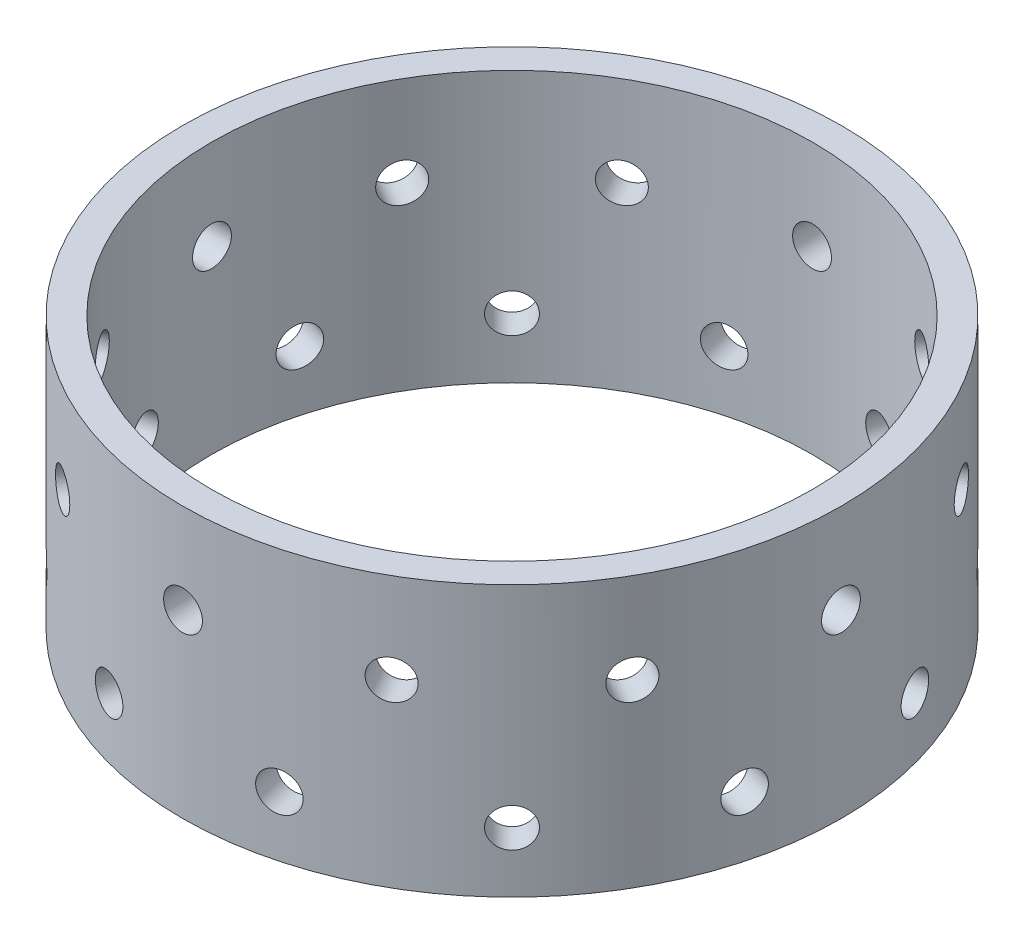
from build123d import *

# Parameters (mm, degrees)
SKETCH1_R               = 69.596
SKETCH1_R_2             = 63.5
BOSS_EXTRUDE1_DEPTH     = 57.15
CUT_EXTRUDE1_REACH      = 167.783
CUT_EXTRUDE1_END_RADIUS = 63.5
SKETCH2_R               = 4.1021
CIRPATTERN1_COUNT       = 12
CUT_EXTRUDE2_REACH      = 174.225
CUT_EXTRUDE2_END_RADIUS = 63.5
SKETCH3_R               = 4.1021
CIRPATTERN2_COUNT       = 12


with BuildPart() as part:
    # Sketch1 → Boss-Extrude1 (new body)
    with BuildSketch(Plane(origin=(0, 0, 0), x_dir=(1, 0, 0), z_dir=(0, 1, 0))):
        with Locations(Location((0, 0, 0), (0, 0, 270))):
            Circle(SKETCH1_R)
        with Locations(Location((0, 0, 0), (0, 0, 270))):
            Circle(SKETCH1_R_2, mode=Mode.SUBTRACT)
    extrude(amount=BOSS_EXTRUDE1_DEPTH)

    # Cut-Extrude1: up to this cylinder (the profile starts outside it)
    cut_extrude1_end = Plane(origin=(0, 38.1, 0), z_dir=(0, -1, 0)) * Cylinder(CUT_EXTRUDE1_END_RADIUS, 463.566, mode=Mode.PRIVATE)
    # Sketch2 → Cut-Extrude1 (cut, up to the surface)
    with BuildSketch(Plane.XY.offset(69.596), mode=Mode.PRIVATE) as cut_extrude1_sk1:
        with Locations((0, 38.1)):
            Circle(SKETCH2_R)
    cut_extrude1_tool1 = extrude(cut_extrude1_sk1.sketch, amount=-CUT_EXTRUDE1_REACH, mode=Mode.PRIVATE) - cut_extrude1_end
    cut_extrude1 = cut_extrude1_tool1.solids().sort_by_distance((0, 38.1, 69.596))[0]
    add(cut_extrude1, mode=Mode.SUBTRACT)

    # CirPattern1: Cut-Extrude1 ×12 about axis
    cirpattern1_axis = Axis((0, 57.15, 0), (0, -1, 0))
    for i in range(1, CIRPATTERN1_COUNT):
        add(cut_extrude1.rotate(cirpattern1_axis, i * 360 / CIRPATTERN1_COUNT), mode=Mode.SUBTRACT)

    # Cut-Extrude2: up to this cylinder (the profile starts outside it)
    cut_extrude2_end = Plane(origin=(0, 12.7, 0), z_dir=(0, -1, 0)) * Cylinder(CUT_EXTRUDE2_END_RADIUS, 476.45, mode=Mode.PRIVATE)
    # Sketch3 → Cut-Extrude2 (cut, up to the surface)
    with BuildSketch(Plane(origin=(18.012770263, 0, -67.224573806), x_dir=(0, -1, 0), z_dir=(0.25881904510252135, 0, -0.9659258262890681)), mode=Mode.PRIVATE) as cut_extrude2_sk1:
        with Locations(Location((-12.7, 0, 0), (0, 0, 90))):
            Circle(SKETCH3_R)
    cut_extrude2_tool1 = extrude(cut_extrude2_sk1.sketch, amount=-CUT_EXTRUDE2_REACH, mode=Mode.PRIVATE) - cut_extrude2_end
    cut_extrude2 = cut_extrude2_tool1.solids().sort_by_distance((18.01277, 12.7, -67.224574))[0]
    add(cut_extrude2, mode=Mode.SUBTRACT)

    # CirPattern2: Cut-Extrude2 ×12 about axis
    cirpattern2_axis = Axis((0, 57.15, 0), (0, -1, 0))
    for i in range(1, CIRPATTERN2_COUNT):
        add(cut_extrude2.rotate(cirpattern2_axis, i * 360 / CIRPATTERN2_COUNT), mode=Mode.SUBTRACT)


solid = part.part
